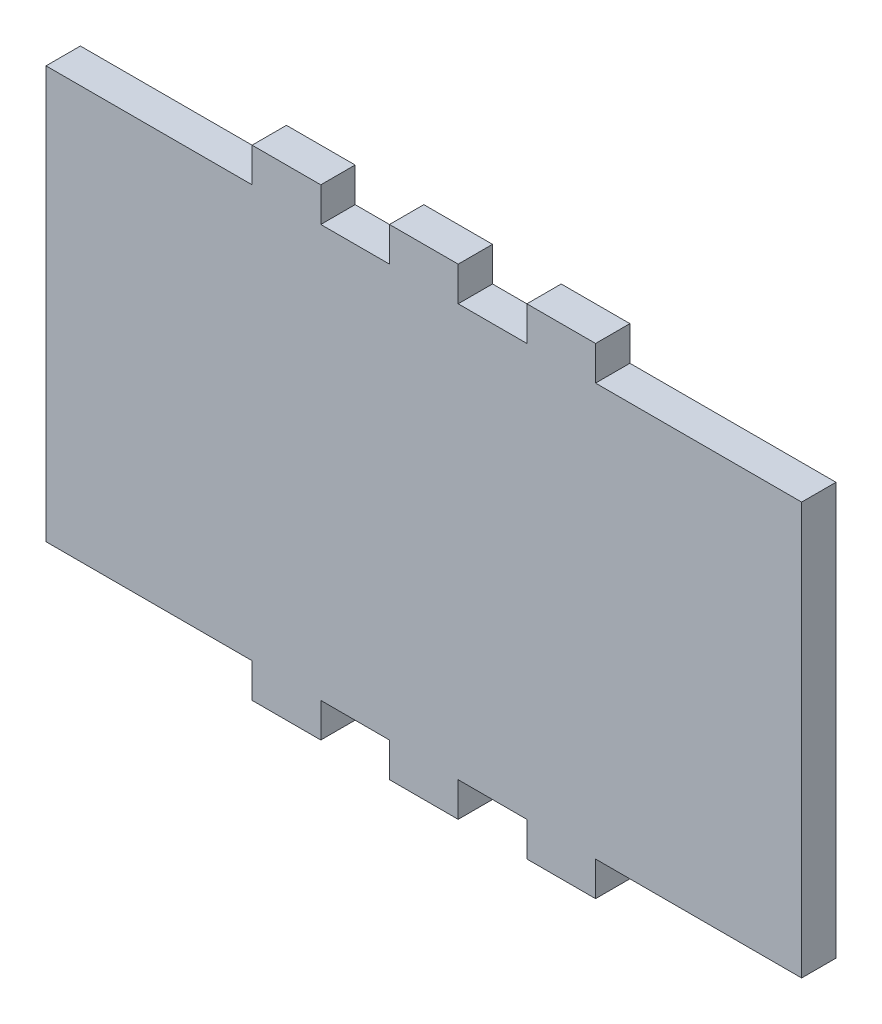
from build123d import *

# Parameters (mm, degrees)
BOSS_EXTRUDE1_DEPTH = 3.175


with BuildPart() as part:
    # Sketch1 → Boss-Extrude1 (new body)
    with BuildSketch(Plane.XY):
        Polygon((-34.925, -19.05), (-34.925, 19.05), (-15.875, 19.05), (-15.875, 22.225), (-9.525, 22.225), (-9.525, 19.05), (-3.175, 19.05), (-3.175, 22.225), (3.175, 22.225), (3.175, 19.05), (9.525, 19.05), (9.525, 22.225), (15.875, 22.225), (15.875, 19.05), (34.925, 19.05), (34.925, -19.05), (15.875, -19.05), (15.875, -22.225), (9.525, -22.225), (9.525, -19.05), (3.175, -19.05), (3.175, -22.225), (-3.175, -22.225), (-3.175, -19.05), (-9.525, -19.05), (-9.525, -22.225), (-15.875, -22.225), (-15.875, -19.05), align=None)
    extrude(amount=BOSS_EXTRUDE1_DEPTH)


solid = part.part
